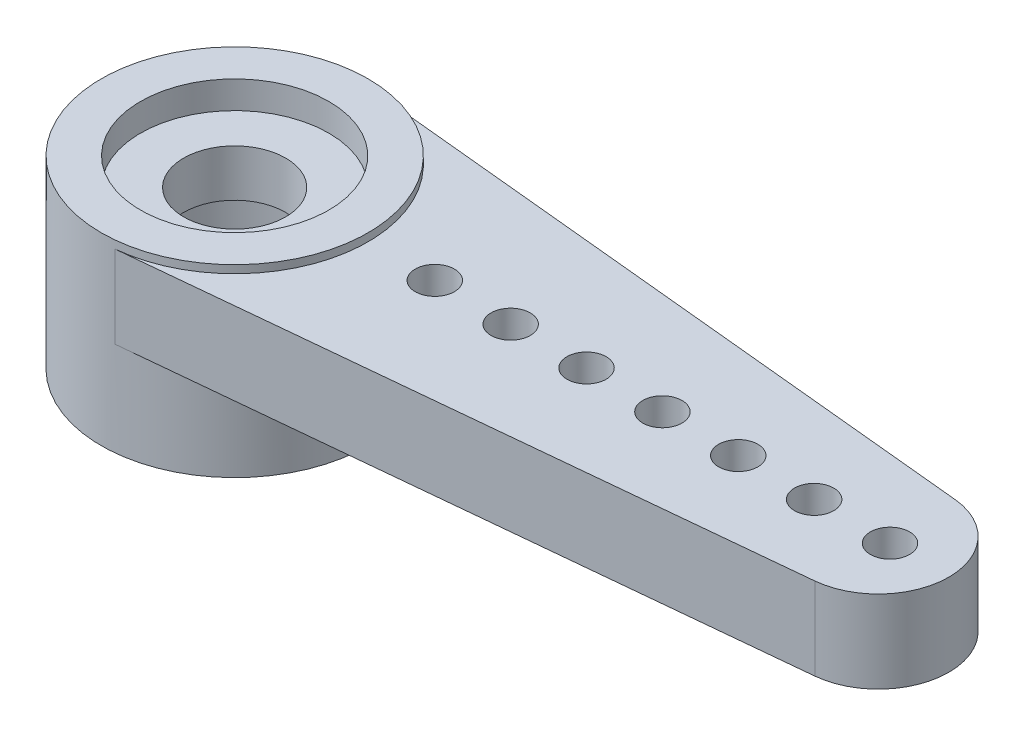
from build123d import *
from build123d.topology import SkipClean

# Parameters (mm, degrees)
SKETCH1_W                    = 3.4
SKETCH1_H                    = 2.4
BOSS_EXTRUDE1_START          = 2.1
BOSS_EXTRUDE1_DEPTH          = 2.1
BOSS_EXTRUDE2_START          = 0.2
SKETCH3_R                    = 3.4
BOSS_EXTRUDE2_DEPTH          = 0.2
F_1_0_1_DIAMETER_HOLE1_D     = 1
F_1_0_1_DIAMETER_HOLE1_DEPTH = 2.3


with BuildPart() as part:
    # Sketch1 → Revolve1 (revolve)
    with BuildSketch(Plane.XY, mode=Mode.PRIVATE) as revolve1_sk:
        with Locations((31.7, -3.5)):
            Rectangle(SKETCH1_W, SKETCH1_H)
    revolve(revolve1_sk.sketch.rotate(Axis((30, -2.3, 0), (0, -1, 0)), 270), axis=Axis((30, -2.3, 0), (0, -1, 0)))

    # Sketch2 → Boss-Extrude1 (add)
    with BuildSketch(Plane(origin=(0, -2.3, 0), x_dir=(-1, 0, 0), z_dir=(0, 1, 0)).offset(BOSS_EXTRUDE1_START)):
        with BuildLine():
            Line((-30.331707317, -3.383780468), (-46.575609756, -1.791413189))
            ThreePointArc((-46.575609756, -1.791413189), (-48.2, 0), (-46.575609756, 1.791413189))
            Line((-46.575609756, 1.791413189), (-30.331707317, 3.383780468))
            ThreePointArc((-30.331707317, 3.383780468), (-26.6, 0), (-30.331707317, -3.383780468))
        make_face()
    extrude(amount=-BOSS_EXTRUDE1_DEPTH)

    # Sketch3 → Boss-Extrude2 (add)
    with SkipClean():  # the faces are left unmerged after this step: merging them gives an invalid solid
        with BuildSketch(Plane(origin=(0, -0.2, 0), x_dir=(-1, 0, 0), z_dir=(0, 1, 0)).offset(BOSS_EXTRUDE2_START)):
            with Locations(Location((-30, 0, 0), (0, 0, 270))):
                Circle(SKETCH3_R)
        extrude(amount=-BOSS_EXTRUDE2_DEPTH)

    # Sketch4 → Cut-Revolve1 (revolve, cut)
    with SkipClean():  # the faces are left unmerged after this step: merging them gives an invalid solid
        with BuildSketch(Plane.XY, mode=Mode.PRIVATE) as cut_revolve1_sk:
            Polygon((32.4, 0), (30, 0), (30, -4.7), (32.4, -4.7), (32.4, -1.9), (31.3, -1.9), (31.3, -0.7), (32.4, -0.7), align=None)
        revolve(cut_revolve1_sk.sketch.rotate(Axis((30, 0, 0), (0, -1, 0)), 270), axis=Axis((30, 0, 0), (0, -1, 0)), mode=Mode.SUBTRACT)

    # Ø1.0 (1) Diameter Hole1
    with Locations(Plane(origin=(0, -2.3, 0), x_dir=(-1, 0, 0), z_dir=(0, -1, 0))):
        with Locations((-40.9, 0), (-42.833333333, 0), (-37.033333333, 0), (-46.7, 0), (-38.966666667, 0), (-44.766666667, 0), (-35.1, 0)):
            Hole(F_1_0_1_DIAMETER_HOLE1_D / 2, depth=F_1_0_1_DIAMETER_HOLE1_DEPTH)


solid = part.part
